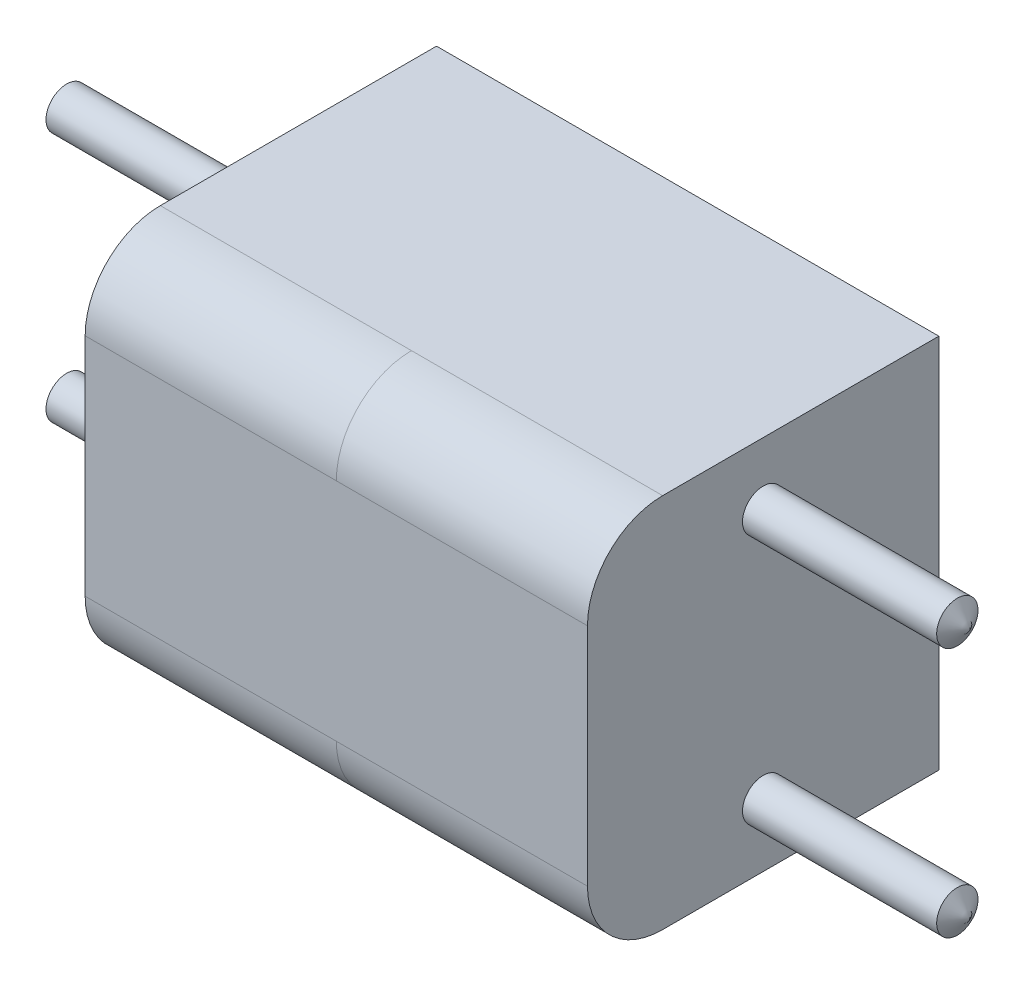
from build123d import *

# Parameters (mm, degrees)
SKIZZE1_W                       = 28.05
SKIZZE1_H                       = 30.0045
AUFSATZ_LINEAR_AUSTRAGEN1_DEPTH = 20.05
VERRUNDUNG1_R                   = 6
SKIZZE2_R                       = 1.65
AUFSATZ_LINEAR_AUSTRAGEN2_DEPTH = 15.5
VERRUNDUNG1_OF_SPIEGELN1_R      = 6


with BuildPart() as part:
    # Skizze1 → Aufsatz-Linear austragen1 (new body)
    with BuildSketch(Plane(origin=(0, 0, 0), x_dir=(0, 0, -1), z_dir=(1, 0, 0))):
        with Locations((-14.025, 0)):
            Rectangle(SKIZZE1_W, SKIZZE1_H)
    aufsatz_linear_austragen1 = extrude(amount=AUFSATZ_LINEAR_AUSTRAGEN1_DEPTH)

    # Verrundung1
    verrundung1_edges = [part.edges().sort_by_distance(p)[0] for p in [
        (10.025, -15.00225, 28.05),
        (10.025, 15.00225, 28.05),
    ]]
    fillet(verrundung1_edges, radius=VERRUNDUNG1_R)

    # Skizze2 → Aufsatz-Linear austragen2 (add)
    with BuildSketch(Plane(origin=(20.05, 0, 0), x_dir=(0, 0, -1), z_dir=(1, 0, 0))):
        with Locations(Location((-14.025, 10, 0), (0, 0, 180))):
            Circle(SKIZZE2_R)
        with Locations(Location((-14.025, -10, 0), (0, 0, 180))):
            Circle(SKIZZE2_R)
    aufsatz_linear_austragen2 = extrude(amount=AUFSATZ_LINEAR_AUSTRAGEN2_DEPTH)

    # Skizze3 → Rotation1 (revolve)
    with BuildSketch(Plane.XY.offset(14.025), mode=Mode.PRIVATE) as rotation1_sk:
        Polygon((35.55, 10), (36.541420021, 10), (35.55, 11.65), align=None)
    rotation1 = revolve(rotation1_sk.sketch.rotate(Axis((35.55, 10, 14.025), (-1, 0, 0)), 270), axis=Axis((35.55, 10, 14.025), (-1, 0, 0)))

    # Skizze4 → Rotation2 (revolve)
    with BuildSketch(Plane.XY.offset(14.025), mode=Mode.PRIVATE) as rotation2_sk:
        Polygon((35.55, -10), (36.541420021, -10), (35.55, -8.35), align=None)
    rotation2 = revolve(rotation2_sk.sketch.rotate(Axis((35.55, -10, 14.025), (-1, 0, 0)), 270), axis=Axis((35.55, -10, 14.025), (-1, 0, 0)))

    # Spiegeln1: Aufsatz-Linear austragen1, Aufsatz-Linear austragen2, Rotation1, Rotation2 across plane
    add(aufsatz_linear_austragen1.mirror(Plane.ZY))
    add(aufsatz_linear_austragen2.mirror(Plane.ZY))
    add(rotation1.mirror(Plane.ZY))
    add(rotation2.mirror(Plane.ZY))

    # Verrundung1 of Spiegeln1
    verrundung1_of_spiegeln1_edges = [part.edges().sort_by_distance(p)[0] for p in [
        (-10.025, -15.00225, 28.05),
        (-10.025, 15.00225, 28.05),
    ]]
    fillet(verrundung1_of_spiegeln1_edges, radius=VERRUNDUNG1_OF_SPIEGELN1_R)


solid = part.part
